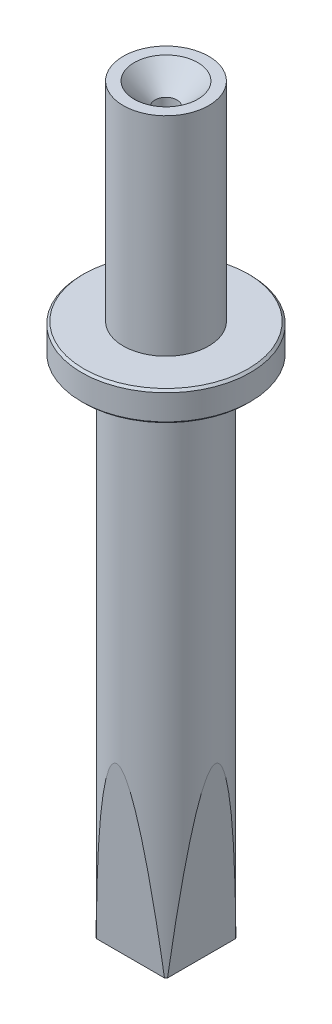
from build123d import *

# Parameters (mm, degrees)
SKETCH_1_R               = 3.9
EXTRUDE_1_DEPTH          = 19
SKETCH_3_R               = 7.7
EXTRUDE_2_DEPTH          = 2.7
SKETCH_4_R               = 3.7
EXTRUDE_3_DEPTH          = 1
SKETCH_5_R               = 4.5
EXTRUDE_4_DEPTH          = 45
CUT_EXTRUDE_1_DEPTH      = 14.75
PATTERN_CIRCULAR_1_COUNT = 4
SKETCH_10_R              = 3.15
CUT_EXTRUDE_2_DEPTH      = 4
CUT_EXTRUDE_START        = -12
SKETCH_11_R              = 2.65
CUT_EXTRUDE_3_DEPTH      = 12
SKETCH_13_R              = 1
SKETCH_12_R              = 2.9
SKETCH_13_2_R            = 1
CUT_EXTRUDE_4_DEPTH      = 3
CHAMFER_1_SIZE           = 0.2


with BuildPart() as part:
    # Эскиз1 → Бобышка-Вытянуть1 (new body)
    with BuildSketch(Plane(origin=(0, 0, 0), x_dir=(1, 0, 0), z_dir=(0, 1, 0))):
        with Locations(Location((0, 0, 0), (0, 0, 270))):
            Circle(SKETCH_1_R)
    extrude(amount=-EXTRUDE_1_DEPTH)

    # Эскиз3 → Бобышка-Вытянуть2 (add)
    with BuildSketch(Plane(origin=(0, -19, 0), x_dir=(1, 0, 0), z_dir=(0, 1, 0))):
        with Locations(Location((0, 0, 0), (0, 0, 270))):
            Circle(SKETCH_3_R)
    extrude(amount=-EXTRUDE_2_DEPTH)

    # Эскиз4 → Бобышка-Вытянуть3 (add)
    with BuildSketch(Plane(origin=(0, -21.7, 0), x_dir=(-1, 0, 0), z_dir=(0, -1, 0))):
        with Locations(Location((0, 0, 0), (0, 0, 90))):
            Circle(SKETCH_4_R)
    extrude(amount=EXTRUDE_3_DEPTH)

    # Эскиз5 → Бобышка-Вытянуть4 (add)
    with BuildSketch(Plane.XZ.offset(22.7)):
        with Locations(Location((0, 0, 0), (0, 0, 90))):
            Circle(SKETCH_5_R)
    extrude(amount=EXTRUDE_4_DEPTH)

    # Эскиз9 → Вырез-Вытянуть1 (cut, symmetric)
    with BuildSketch(Plane.XY):
        Polygon((4.5, -51.7), (3.25, -67.7), (4.5, -67.7), align=None)
    cut_extrude_1 = extrude(amount=CUT_EXTRUDE_1_DEPTH, both=True, mode=Mode.SUBTRACT)

    # Круговой массив1: Вырез-Вытянуть1 ×4 about axis
    pattern_circular_1_axis = Axis((0, 0, 0), (0, 1, 0))
    for i in range(1, PATTERN_CIRCULAR_1_COUNT):
        add(cut_extrude_1.rotate(pattern_circular_1_axis, i * 360 / PATTERN_CIRCULAR_1_COUNT), mode=Mode.SUBTRACT)

    # Эскиз10 → Вырез-Вытянуть2 (cut)
    with BuildSketch(Plane.XZ.offset(67.7)):
        with Locations(Location((0, 0, 0), (0, 0, 270))):
            Circle(SKETCH_10_R)
    extrude(amount=-CUT_EXTRUDE_2_DEPTH, mode=Mode.SUBTRACT)

    # Эскиз11 → Вырез-Вытянуть3 (cut)
    with BuildSketch(Plane.XZ.offset(63.7).offset(CUT_EXTRUDE_START)):
        with Locations(Location((0, 0, 0), (0, 0, 270))):
            Circle(SKETCH_11_R)
    extrude(amount=CUT_EXTRUDE_3_DEPTH, mode=Mode.SUBTRACT)

    # Эскиз13 → Вырез-По сечениям1 section 0
    with BuildSketch(Plane(origin=(0, -2, 0), x_dir=(1, 0, 0), z_dir=(0, 1, 0))):
        Circle(SKETCH_13_R)
    # Эскиз12 → Вырез-По сечениям1 section 1
    with BuildSketch(Plane(origin=(0, 0, 0), x_dir=(1, 0, 0), z_dir=(0, 1, 0))):
        Circle(SKETCH_12_R)
    loft(mode=Mode.SUBTRACT)

    # Эскиз13<2> → Вырез-Вытянуть4 (cut)
    with BuildSketch(Plane(origin=(0, -2, 0), x_dir=(1, 0, 0), z_dir=(0, 1, 0))):
        with Locations(Location((0, 0, 0), (0, 0, 270))):
            Circle(SKETCH_13_2_R)
    extrude(amount=-CUT_EXTRUDE_4_DEPTH, mode=Mode.SUBTRACT)

    # Фаска1
    chamfer_1_edges = [part.edges().sort_by_distance(p)[0] for p in [
        (0, -21.7, -7.7),
        (0, -19, -7.7),
    ]]
    chamfer(chamfer_1_edges, length=CHAMFER_1_SIZE)


solid = part.part
